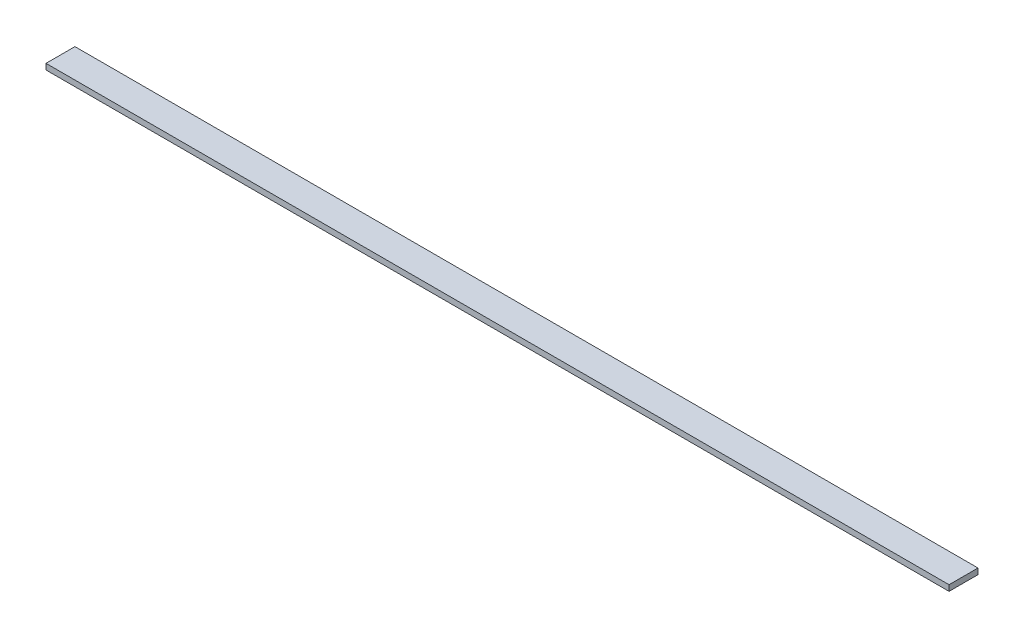
from build123d import *

# Parameters (mm, degrees)
SKETCH1_W           = 312
SKETCH1_H           = 10
BOSS_EXTRUDE1_DEPTH = 2


with BuildPart() as part:
    # Sketch1 → Boss-Extrude1 (new body)
    with BuildSketch(Plane(origin=(0, 0, 0), x_dir=(1, 0, 0), z_dir=(0, 1, 0))):
        with Locations((156, 5)):
            Rectangle(SKETCH1_W, SKETCH1_H)
    extrude(amount=BOSS_EXTRUDE1_DEPTH)


solid = part.part
